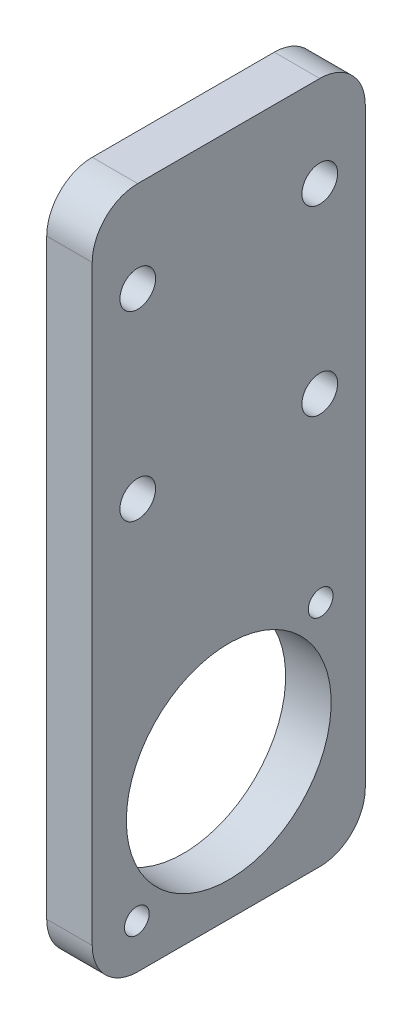
from build123d import *

# Parameters (mm, degrees)
SKETCH1_R           = 1.7272
SKETCH1_R_2         = 14.2875
SKETCH1_R_3         = 2.4892
BOSS_EXTRUDE1_DEPTH = 6.35


with BuildPart() as part:
    # Sketch1 → Boss-Extrude1 (new body)
    with BuildSketch(Plane(origin=(95.25, 0, 0), x_dir=(0, 0, -1), z_dir=(1, 0, 0))):
        with BuildLine():
            Line((-184.15, -107.95), (-184.15, -25.4))
            ThreePointArc((-184.15, -25.4), (-186.009871939, -20.909871939), (-190.5, -19.05))
            Line((-190.5, -19.05), (-215.9, -19.05))
            ThreePointArc((-215.9, -19.05), (-220.390128061, -20.909871939), (-222.25, -25.4))
            Line((-222.25, -25.4), (-222.25, -107.95))
            ThreePointArc((-222.25, -107.95), (-220.390128061, -112.440128061), (-215.9, -114.3))
            Line((-215.9, -114.3), (-190.5, -114.3))
            ThreePointArc((-190.5, -114.3), (-186.009871939, -112.440128061), (-184.15, -107.95))
        make_face()
        with Locations(Location((-190.376194259, -82.426194259, 0), (0, 0, 180))):
            Circle(SKETCH1_R, mode=Mode.SUBTRACT)
        with Locations(Location((-216.023805741, -108.073805741, 0), (0, 0, 180))):
            Circle(SKETCH1_R, mode=Mode.SUBTRACT)
        with Locations(Location((-203.2, -95.25, 0), (0, 0, 180))):
            Circle(SKETCH1_R_2, mode=Mode.SUBTRACT)
        with Locations(Location((-215.9, -31.75, 0), (0, 0, 180))):
            Circle(SKETCH1_R_3, mode=Mode.SUBTRACT)
        with Locations(Location((-190.5, -31.75, 0), (0, 0, 180))):
            Circle(SKETCH1_R_3, mode=Mode.SUBTRACT)
        with Locations(Location((-215.9, -57.15, 0), (0, 0, 180))):
            Circle(SKETCH1_R_3, mode=Mode.SUBTRACT)
        with Locations(Location((-190.5, -57.15, 0), (0, 0, 180))):
            Circle(SKETCH1_R_3, mode=Mode.SUBTRACT)
    extrude(amount=-BOSS_EXTRUDE1_DEPTH)


solid = part.part
